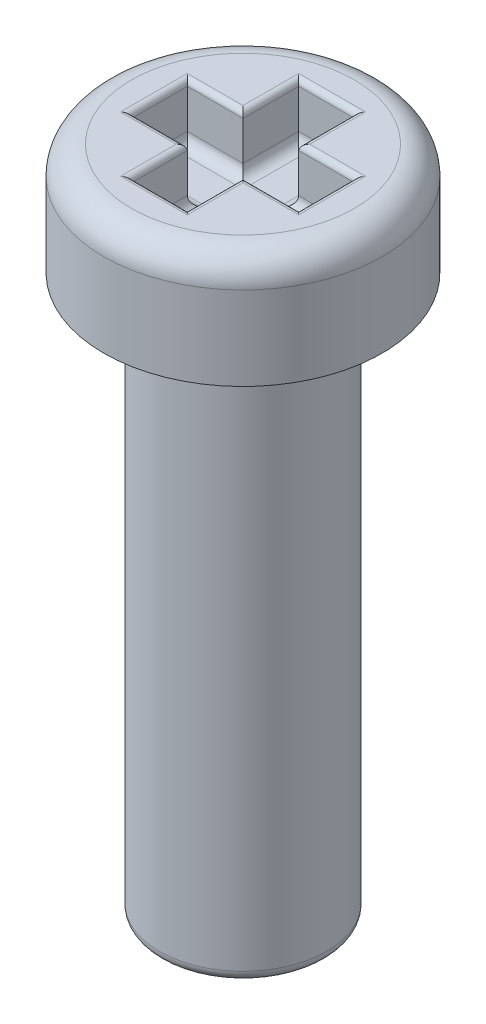
from build123d import *

# Parameters (mm, degrees)
SKETCH1_R           = 1.5
BOSS_EXTRUDE1_DEPTH = 10
FILLET1_R           = 0.2
SKETCH2_W           = 2.5
SKETCH2_H           = 2
CUT_EXTRUDE1_DEPTH  = 1
FILLET3_R           = 0.1
FILLET4_R           = 0.2
FILLET5_R           = 0.5


with BuildPart() as part:
    # Sketch1 → Boss-Extrude1 (new body)
    with BuildSketch(Plane(origin=(0, 0, 0), x_dir=(1, 0, 0), z_dir=(0, 1, 0))):
        with Locations(Location((0, 0, 0), (0, 0, 270))):
            Circle(SKETCH1_R)
    extrude(amount=BOSS_EXTRUDE1_DEPTH)

    # Fillet1
    fillet1_edges = [part.edges().sort_by_distance(p)[0] for p in [
        (0, 0, -1.5),
    ]]
    fillet(fillet1_edges, radius=FILLET1_R)

    # Sketch2 → Revolve1 (revolve)
    with BuildSketch(Plane.XY, mode=Mode.PRIVATE) as revolve1_sk:
        with Locations((-1.25, 11)):
            Rectangle(SKETCH2_W, SKETCH2_H)
    revolve(revolve1_sk.sketch.rotate(Axis((0, 0, 0), (0, 1, 0)), 270), axis=Axis((0, 0, 0), (0, 1, 0)))

    # Sketch3 → Cut-Extrude1 (cut)
    with BuildSketch(Plane(origin=(0, 12, 0), x_dir=(1, 0, 0), z_dir=(0, 1, 0))):
        Polygon((-0.5, 0.5), (-1.5, 0.5), (-1.5, -0.5), (-0.5, -0.5), (-0.5, -1.5), (0.5, -1.5), (0.5, -0.5), (1.5, -0.5), (1.5, 0.5), (0.5, 0.5), (0.5, 1.5), (-0.5, 1.5), align=None)
    extrude(amount=-CUT_EXTRUDE1_DEPTH, mode=Mode.SUBTRACT)

    # Fillet3
    fillet3_edges = [part.edges().sort_by_distance(p)[0] for p in [
        (0.5, 12, 1),
        (1, 12, 0.5),
        (1.5, 12, 0),
        (1, 12, -0.5),
        (0.5, 12, -1),
        (0, 12, -1.5),
        (-0.5, 12, -1),
        (-1, 12, -0.5),
        (-1.5, 12, 0),
        (-1, 12, 0.5),
        (-0.5, 12, 1),
        (0, 12, 1.5),
    ]]
    fillet(fillet3_edges, radius=FILLET3_R)

    # Fillet4
    fillet4_edges = [part.edges().sort_by_distance(p)[0] for p in [
        (0.5, 11, 1),
        (0, 11, 1.5),
        (-0.5, 11, 1),
        (-1, 11, 0.5),
        (-1.5, 11, 0),
        (-1, 11, -0.5),
        (-0.5, 11, -1),
        (0, 11, -1.5),
        (0.5, 11, -1),
        (1, 11, -0.5),
        (1.5, 11, 0),
        (1, 11, 0.5),
    ]]
    fillet(fillet4_edges, radius=FILLET4_R)

    # Fillet5
    fillet5_edges = [part.edges().sort_by_distance(p)[0] for p in [
        (0, 12, 2.5),
    ]]
    fillet(fillet5_edges, radius=FILLET5_R)


solid = part.part
